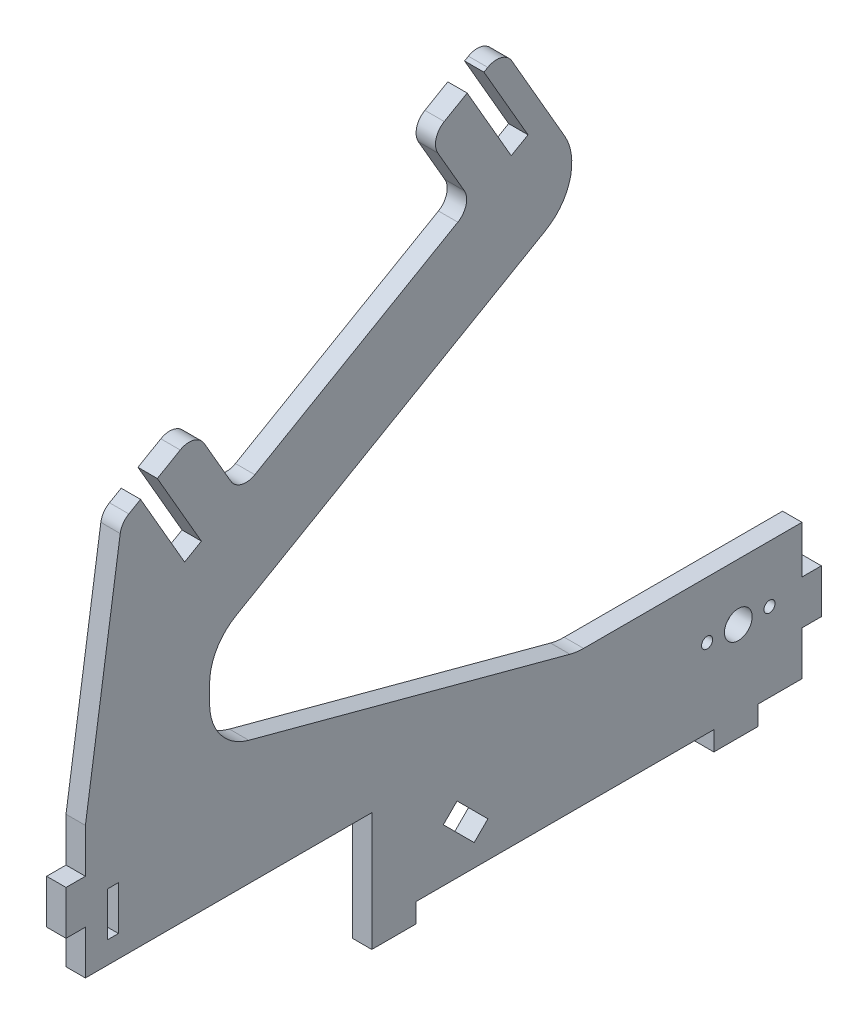
from build123d import *

# Parameters (mm, degrees)
BOSS_EXTRUDE1_DEPTH = 2.794
SKETCH2_W           = 1.5875
SKETCH2_H           = 6.35
CUT_EXTRUDE1_DEPTH  = 158.264546986
FILLET2_R           = 2.54
FILLET3_R           = 7.62
SKETCH4_R           = 2
SKETCH4_R_2         = 0.8
CUT_EXTRUDE2_DEPTH  = 157.484941985
CUT_EXTRUDE3_DEPTH  = 157.484941985
CUT_EXTRUDE4_DEPTH  = 157.484941985


with BuildPart() as part:
    # Sketch1 → Boss-Extrude1 (new body)
    with BuildSketch(Plane.ZY.offset(-5.715)):
        Polygon((-20.646158347, 31.796360983), (-20.646158347, 38.146360983), (-23.440158347, 38.146360983), (-23.440158347, 44.496360983), (-20.646158347, 44.496360983), (-20.646158347, 51.321360983), (11.831425782, 51.321360983), (64.730392893, 65.495596501), (64.730392893, 78.265338355), (9.737779753, 110.015338355), (22.437779753, 132.012383611), (33.106346702, 125.852883611), (26.756346702, 114.854360983), (60.411825944, 95.423360983), (66.761825944, 106.421883611), (77.430392893, 100.262383611), (82.628841653, 65.133860983), (82.628841653, 58.783860983), (85.422841653, 58.783860983), (85.422841653, 52.433860983), (82.628841653, 52.433860983), (82.628841653, 46.083860983), (41.353841653, 46.083860983), (41.353841653, 29.002360983), (35.003841653, 29.002360983), (35.003841653, 31.796360983), (-7.946158347, 31.796360983), (-7.946158347, 29.002360983), (-14.296158347, 29.002360983), (-14.296158347, 31.796360983), align=None)
    extrude(amount=BOSS_EXTRUDE1_DEPTH)

    # Sketch2 → Cut-Extrude1 (cut, through all)
    with BuildSketch(Plane.ZY.offset(-2.921)):
        with Locations((78.660091653, 52.433860983)):
            Rectangle(SKETCH2_W, SKETCH2_H)
    extrude(amount=-CUT_EXTRUDE1_DEPTH, mode=Mode.SUBTRACT)

    # Fillet2
    fillet2_edges = [part.edges().sort_by_distance(p)[0] for p in [
        (4.318, 95.423360983, 60.411825944),
        (4.318, 114.854360983, 26.756346702),
        (4.318, 100.262383611, 77.430392893),
        (4.318, 106.421883611, 66.761825944),
        (4.318, 125.852883611, 33.106346702),
        (4.318, 132.012383611, 22.437779753),
    ]]
    fillet(fillet2_edges, radius=FILLET2_R)

    # Fillet3
    fillet3_edges = [part.edges().sort_by_distance(p)[0] for p in [
        (4.318, 51.321360983, 11.831425782),
        (4.318, 78.265338355, 64.730392893),
        (4.318, 65.495596501, 64.730392893),
        (4.318, 110.015338355, 9.737779753),
    ]]
    fillet(fillet3_edges, radius=FILLET3_R)

    # Sketch4 → Cut-Extrude2 (cut, through all)
    with BuildSketch(Plane.ZY.offset(-2.921)):
        with Locations((-11.471158347, 43.146360983)):
            Circle(SKETCH4_R)
        with Locations((-6.971158347, 43.146360983)):
            Circle(SKETCH4_R_2)
        with Locations((-15.971158347, 43.146360983)):
            Circle(SKETCH4_R_2)
    extrude(amount=-CUT_EXTRUDE2_DEPTH, mode=Mode.SUBTRACT)

    # Sketch5 → Cut-Extrude3 (cut, through all)
    with BuildSketch(Plane.ZY.offset(-2.921)):
        Polygon((29.065685306, 41.392017329), (24.619477371, 36.945809394), (26.595133717, 34.970153047), (31.041341653, 39.416360983), align=None)
    extrude(amount=-CUT_EXTRUDE3_DEPTH, mode=Mode.SUBTRACT)

    # Sketch7 → Cut-Extrude4 (cut, through all)
    with BuildSketch(Plane.ZY.offset(-2.921)):
        Polygon((27.607085388, 129.027883611), (21.257085388, 118.029360983), (18.83741041, 119.426360983), (25.18741041, 130.424883611), align=None)
        Polygon((74.680762236, 101.849883611), (68.330762236, 90.851360983), (65.911087258, 92.248360983), (72.261087258, 103.246883611), align=None)
    extrude(amount=-CUT_EXTRUDE4_DEPTH, mode=Mode.SUBTRACT)


solid = part.part
